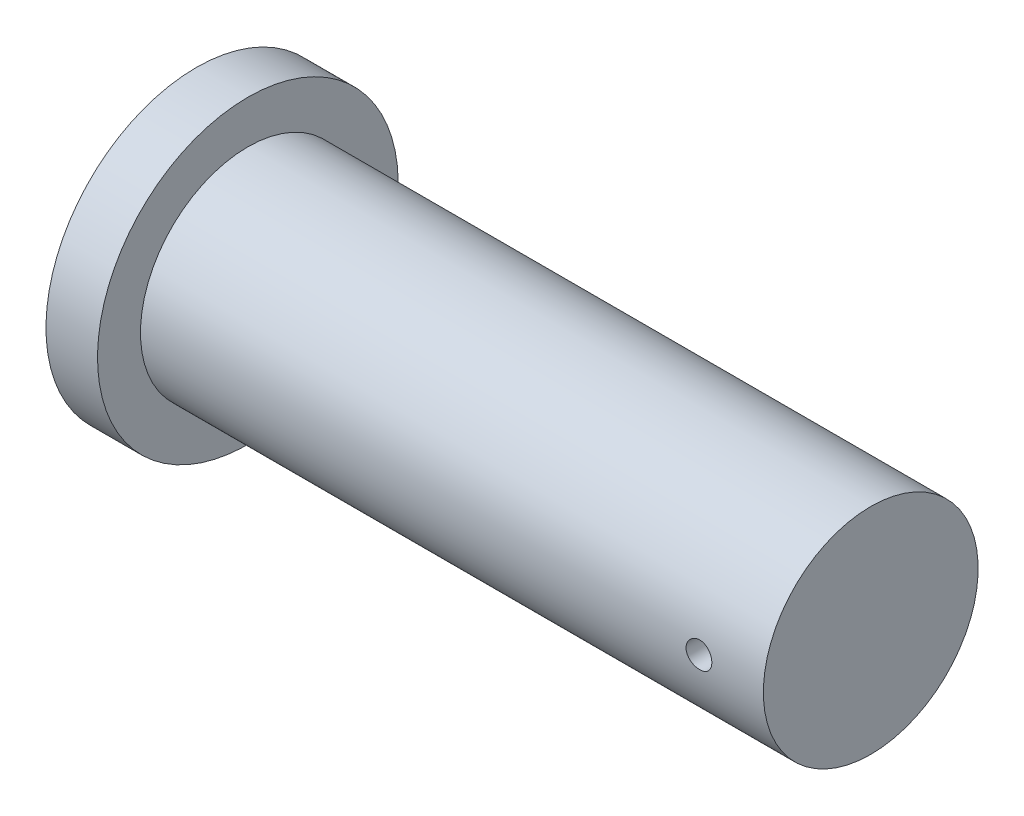
from build123d import *

# Parameters (mm, degrees)
SKETCH3_R          = 30
CUT_EXTRUDE1_DEPTH = 428.5


with BuildPart() as part:
    # Sketch1 → Revolve1 (revolve)
    with BuildSketch(Plane.XY):
        Polygon((0, 0), (-1570, 0), (-1570, 350), (-1450, 350), (-1450, 250), (0, 250), align=None)
    revolve(axis=Axis((0, 0, 0), (-1, 0, 0)))

    # Sketch3 → Cut-Extrude1 (cut, symmetric)
    with BuildSketch(Plane.XY):
        with Locations((-150, 0)):
            Circle(SKETCH3_R)
    extrude(amount=CUT_EXTRUDE1_DEPTH, both=True, mode=Mode.SUBTRACT)


solid = part.part
